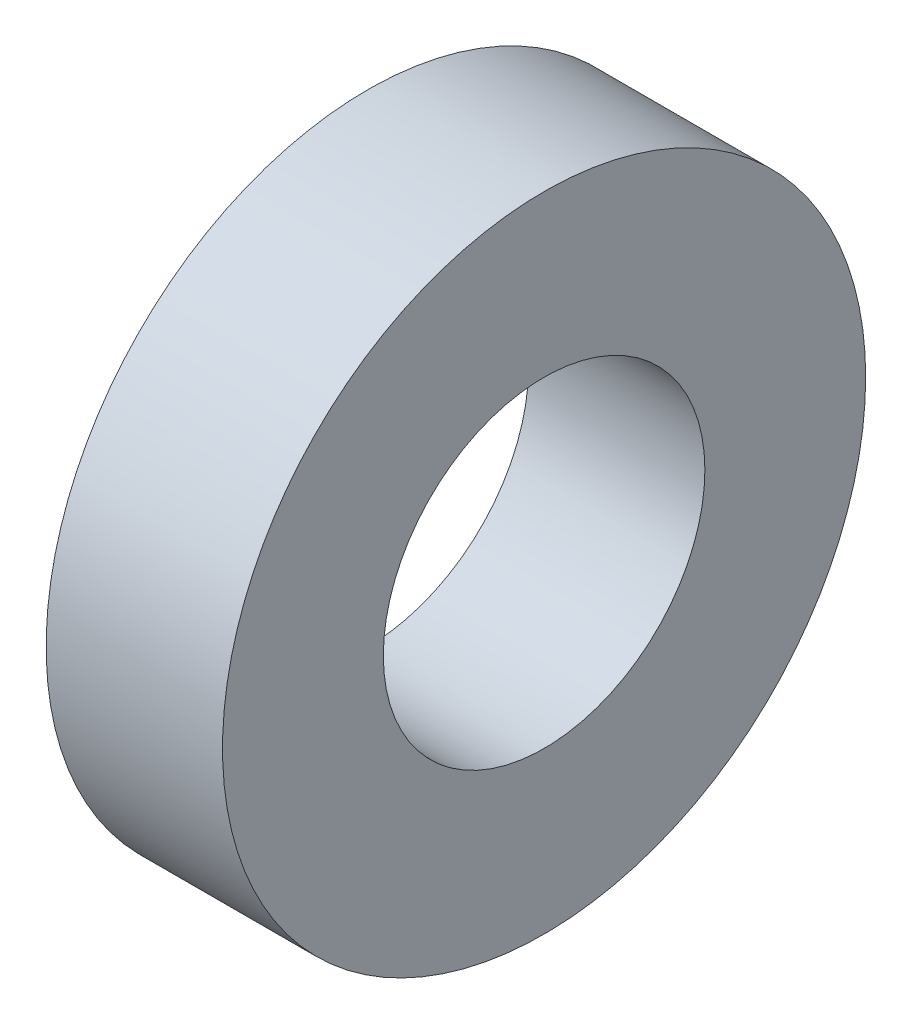
from build123d import *

# Parameters (mm, degrees)
SKETCH1_R           = 12.7
SKETCH1_R_2         = 6.35
BOSS_EXTRUDE1_DEPTH = 6.96595


with BuildPart() as part:
    # Sketch1 → Boss-Extrude1 (new body)
    with BuildSketch(Plane(origin=(0, 0, 0), x_dir=(0, 0, -1), z_dir=(1, 0, 0))):
        Circle(SKETCH1_R)
        Circle(SKETCH1_R_2, mode=Mode.SUBTRACT)
    extrude(amount=BOSS_EXTRUDE1_DEPTH)


solid = part.part
